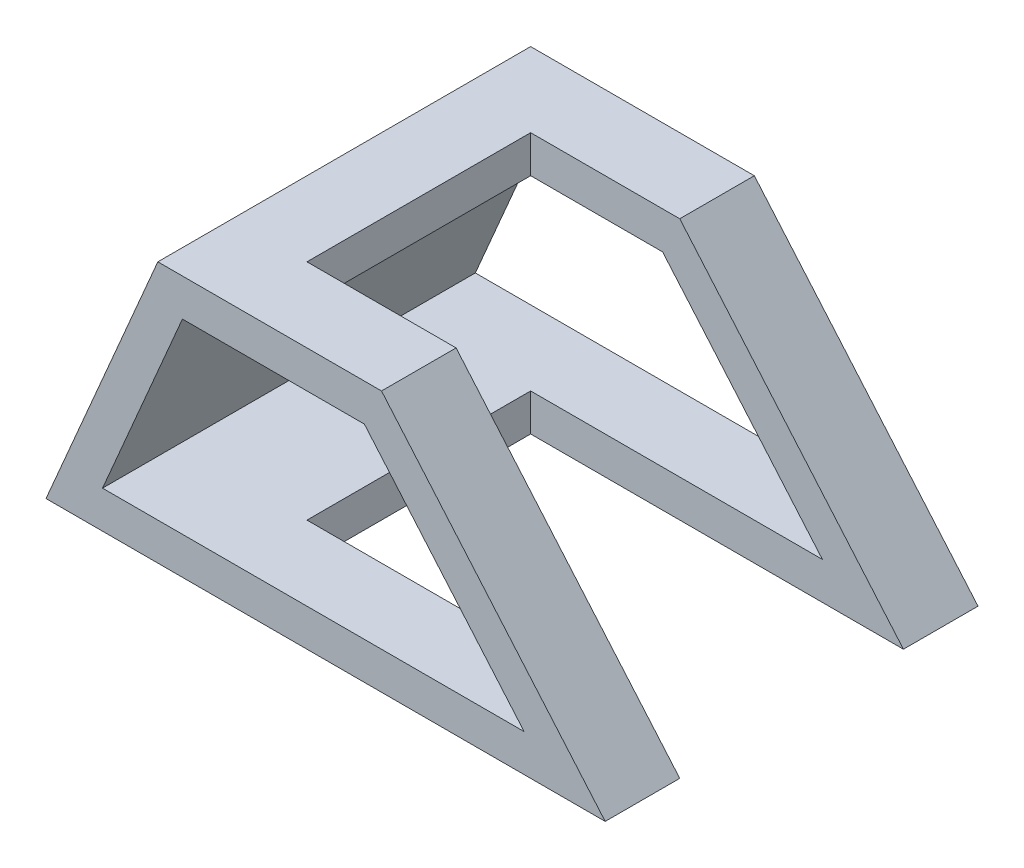
from build123d import *

# Parameters (mm, degrees)
BOSS_EXTRUDE1_DEPTH = 100
SKETCH2_W           = 100
SKETCH2_H           = 60
CUT_EXTRUDE1_DEPTH  = 194.390796058


with BuildPart() as part:
    # Sketch1 → Boss-Extrude1 (new body)
    with BuildSketch(Plane.XY):
        Polygon((0, 0), (150, 0), (90, 70), (30, 70), align=None)
        Polygon((36.59396158, 60), (15.165390151, 10), (128.257793632, 10), (85.400650775, 60), align=None, mode=Mode.SUBTRACT)
    extrude(amount=BOSS_EXTRUDE1_DEPTH)

    # Sketch2 → Cut-Extrude1 (cut, through all)
    with BuildSketch(Plane(origin=(0, 70, 0), x_dir=(1, 0, 0), z_dir=(0, 1, 0))):
        with Locations((100, -50)):
            Rectangle(SKETCH2_W, SKETCH2_H)
    extrude(amount=-CUT_EXTRUDE1_DEPTH, mode=Mode.SUBTRACT)


solid = part.part
